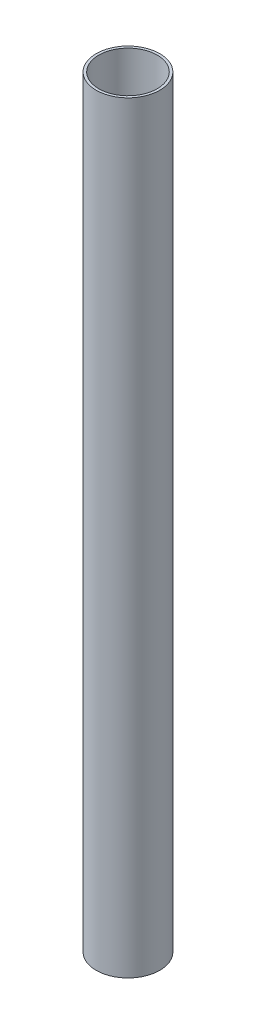
from build123d import *

# Parameters (mm, degrees)
SKETCH1_R           = 38.1
BOSS_EXTRUDE1_DEPTH = 914.4
SKETCH2_R           = 35.052
CUT_EXTRUDE1_DEPTH  = 916.986124349


with BuildPart() as part:
    # Sketch1 → Boss-Extrude1 (new body)
    with BuildSketch(Plane(origin=(0, 0, 0), x_dir=(1, 0, 0), z_dir=(0, 1, 0))):
        with Locations(Location((0, 0, 0), (0, 0, 270))):
            Circle(SKETCH1_R)
    extrude(amount=-BOSS_EXTRUDE1_DEPTH)

    # Sketch2 → Cut-Extrude1 (cut, through all)
    with BuildSketch(Plane(origin=(0, 0, 0), x_dir=(1, 0, 0), z_dir=(0, 1, 0))):
        with Locations(Location((0, 0, 0), (0, 0, 270))):
            Circle(SKETCH2_R)
    extrude(amount=-CUT_EXTRUDE1_DEPTH, mode=Mode.SUBTRACT)


solid = part.part
